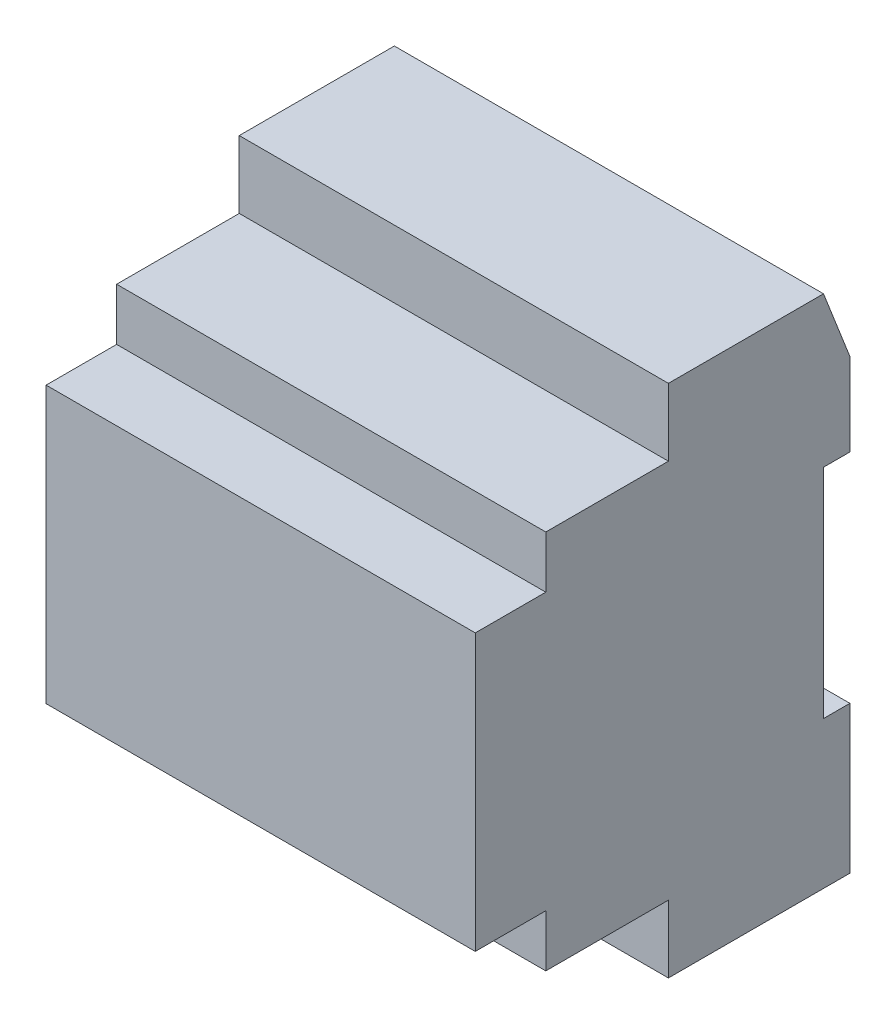
from build123d import *

# Parameters (mm, degrees)
ESTRUSIONE_ESTRUSIONE1_DEPTH = 70
SCHIZZO2_W                   = 40
SCHIZZO2_H                   = 4.3
ESTRUSIONE_ESTRUSIONE2_DEPTH = 4.8


with BuildPart() as part:
    # Schizzo1 → Estrusione-Estrusione1 (new body)
    with BuildSketch(Plane(origin=(0, 0, 0), x_dir=(0, 0, -1), z_dir=(1, 0, 0))):
        Polygon((-61.1, 64.5), (-61.1, 19.5), (-49.6, 19.5), (-49.6, 11), (-29.6, 11), (-29.6, 0), (0, 0), (0, 24), (-4.3, 24), (-4.3, 59.5), (0, 59.5), (0, 73), (-4.3, 84), (-29.6, 84), (-29.6, 73), (-49.6, 73), (-49.6, 64.5), align=None)
    extrude(amount=ESTRUSIONE_ESTRUSIONE1_DEPTH)

    # Schizzo2 → Estrusione-Estrusione2 (add)
    with BuildSketch(Plane.XZ):
        with Locations((35, 2.15)):
            Rectangle(SCHIZZO2_W, SCHIZZO2_H)
    extrude(amount=ESTRUSIONE_ESTRUSIONE2_DEPTH)


solid = part.part
